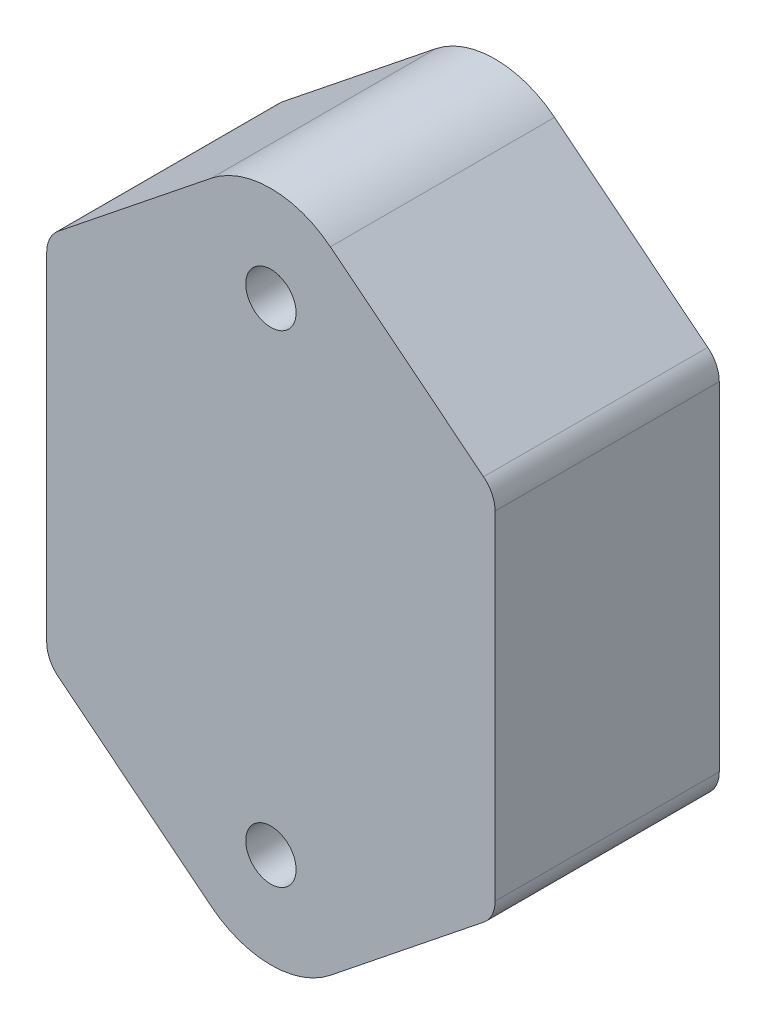
from build123d import *

# Parameters (mm, degrees)
SKETCH1_R           = 2.0828
BOSS_EXTRUDE1_DEPTH = 18.542


with BuildPart() as part:
    # Sketch1 → Boss-Extrude1 (new body)
    with BuildSketch(Plane.XY):
        with BuildLine():
            Line((-2.54, 0), (-2.54, 27.94))
            ThreePointArc((-2.54, 27.94), (-2.289263959, 29.040395622), (-1.586558642, 29.923540188))
            Line((-1.586558642, 29.923540188), (11.083668211, 40.057974582))
            ThreePointArc((11.083668211, 40.057974582), (16.002, 41.783), (20.920331789, 40.057974582))
            Line((20.920331789, 40.057974582), (33.590558642, 29.923540188))
            ThreePointArc((33.590558642, 29.923540188), (34.293263959, 29.040395622), (34.544, 27.94))
            Line((34.544, 27.94), (34.544, 0))
            ThreePointArc((34.544, 0), (34.293263959, -1.100395622), (33.590558642, -1.983540188))
            Line((33.590558642, -1.983540188), (20.920331789, -12.117974582))
            ThreePointArc((20.920331789, -12.117974582), (16.002, -13.843), (11.083668211, -12.117974582))
            Line((11.083668211, -12.117974582), (-1.586558642, -1.983540188))
            ThreePointArc((-1.586558642, -1.983540188), (-2.289263959, -1.100395622), (-2.54, 0))
        make_face()
        with Locations((16.002, 33.909)):
            Circle(SKETCH1_R, mode=Mode.SUBTRACT)
        with Locations((16.002, -5.969)):
            Circle(SKETCH1_R, mode=Mode.SUBTRACT)
    extrude(amount=BOSS_EXTRUDE1_DEPTH)


solid = part.part
